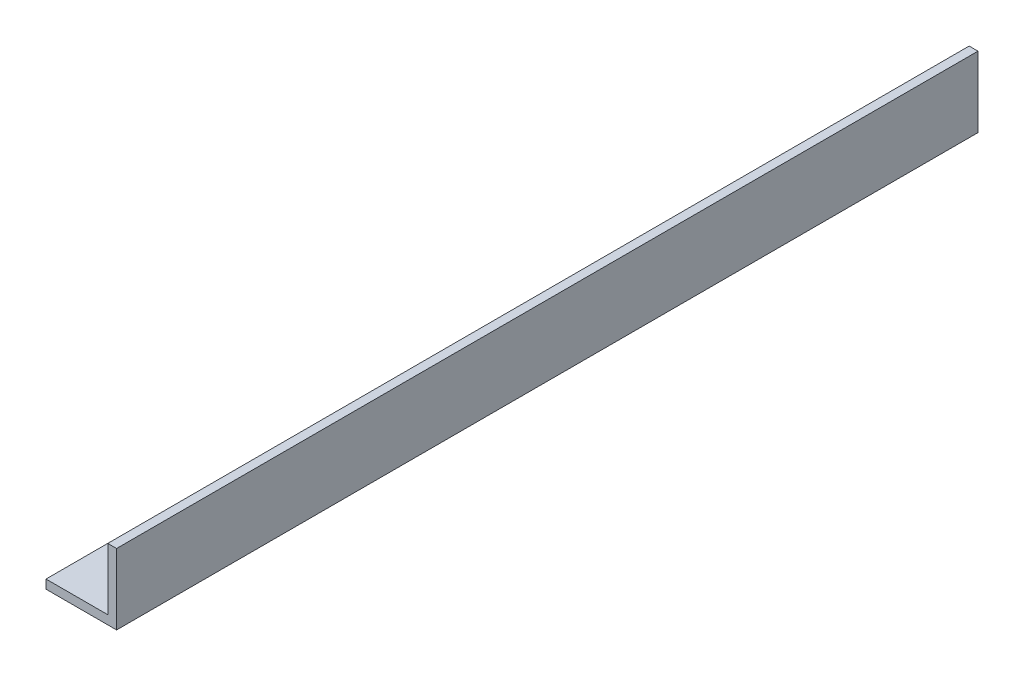
from build123d import *

# Parameters (mm, degrees)
BOSS_EXTRUDE1_DEPTH = 310
SKETCH2_R           = 2
CUT_EXTRUDE1_DEPTH  = 310


with BuildPart() as part:
    # Sketch1 → Boss-Extrude1 (new body)
    with BuildSketch(Plane.XY):
        Polygon((0, 0), (25.4, 0), (25.4, 25.4), (22.225, 25.4), (22.225, 3.175), (0, 3.175), align=None)
    extrude(amount=BOSS_EXTRUDE1_DEPTH)

    # Sketch2 → Cut-Extrude1 (cut)
    with BuildSketch(Plane.XZ):
        with Locations(Location((12.7, 290, 0), (0, 0, 270))):
            Circle(SKETCH2_R)
        with Locations(Location((12.7, 20, 0), (0, 0, 270))):
            Circle(SKETCH2_R)
    extrude(amount=-CUT_EXTRUDE1_DEPTH, mode=Mode.SUBTRACT)


solid = part.part
